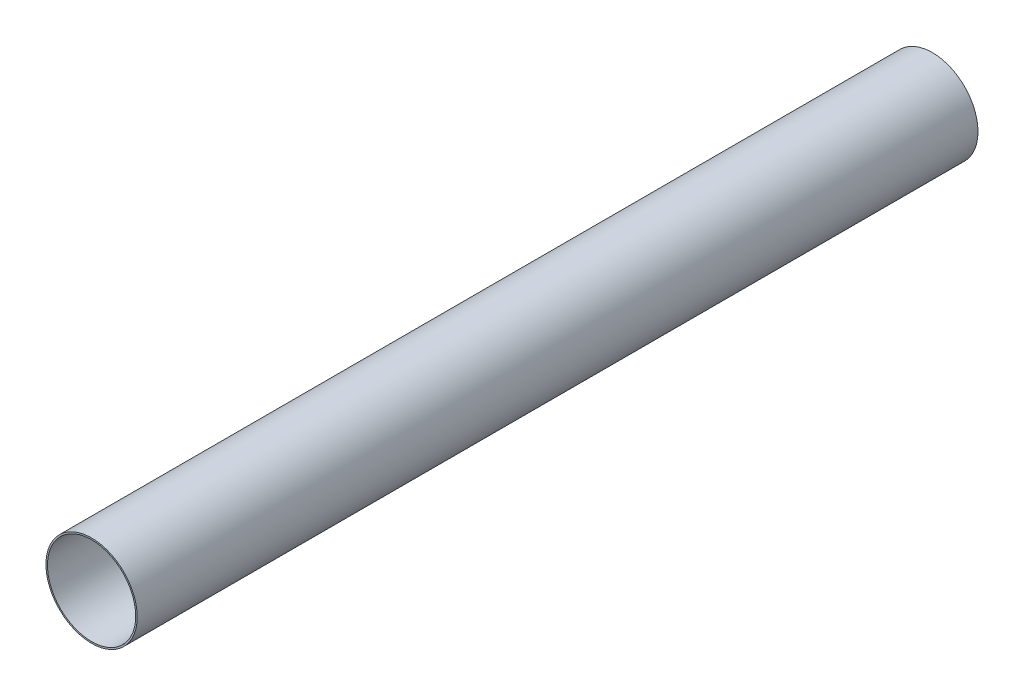
from build123d import *

# Parameters (mm, degrees)
SKETCH1_R           = 15.1765
SKETCH1_R_2         = 14.6685
BOSS_EXTRUDE1_DEPTH = 279.4


with BuildPart() as part:
    # Sketch1 → Boss-Extrude1 (new body)
    with BuildSketch(Plane.XY):
        Circle(SKETCH1_R)
        Circle(SKETCH1_R_2, mode=Mode.SUBTRACT)
    extrude(amount=BOSS_EXTRUDE1_DEPTH)


solid = part.part
